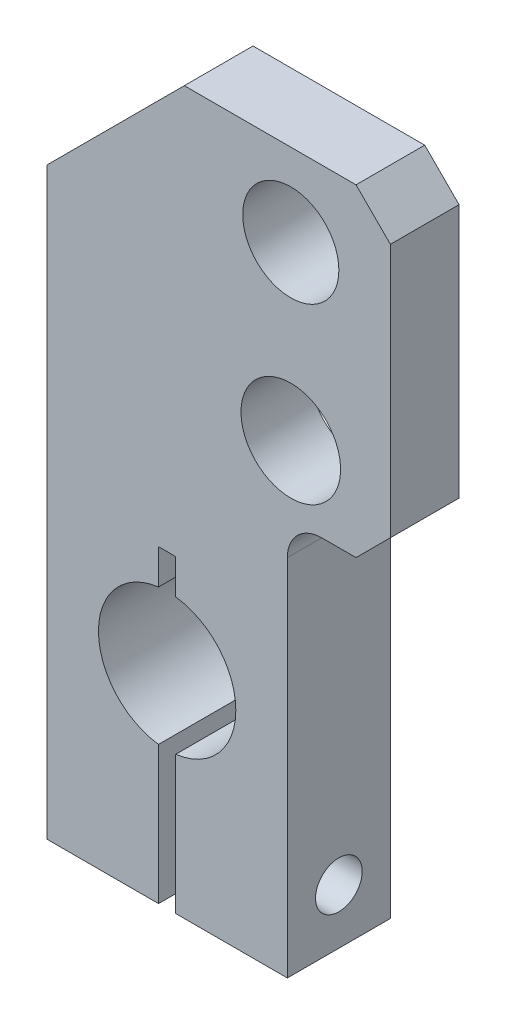
from build123d import *

# Parameters (mm, degrees)
EXTRUDE_1_DEPTH     = 7.5
SKETCH_2_R          = 10
CUT_EXTRUDE_1_DEPTH = 111.933538662
SKETCH_3_W          = 2.5
SKETCH_3_H          = 45
CUT_EXTRUDE_2_DEPTH = 111.933538662
FILLET_1_R          = 5
SKETCH_4_R          = 4.25
CUT_EXTRUDE_3_DEPTH = 16.25
M8X1_25_1_D         = 6.8
SKETCH_10_R         = 7
CUT_EXTRUDE_4_DEPTH = 111.933538662
SKETCH_11_W         = 50
SKETCH_11_H         = 50
CUT_EXTRUDE_5_DEPTH = 5
CHAMFER_2_SIZE      = 5
CHAMFER_3_SIZE      = 20
SKETCH_12_R         = 7.25
CUT_EXTRUDE_6_DEPTH = 111.368700273


with BuildPart() as part:
    # 草图1 → 凸台-拉伸1 (new, symmetric)
    with BuildSketch(Plane.XY):
        Polygon((-17.5, 105), (-17.5, 0), (17.5, 0), (17.5, 58), (32.5, 58), (32.5, 105), align=None)
    extrude(amount=EXTRUDE_1_DEPTH, both=True)

    # 草图2 → 切除-拉伸1 (cut, through all)
    with BuildSketch(Plane.XY.offset(7.5)):
        with Locations((0, 30)):
            Circle(SKETCH_2_R)
    extrude(amount=-CUT_EXTRUDE_1_DEPTH, mode=Mode.SUBTRACT)

    # 草图3 → 切除-拉伸2 (cut, through all)
    with BuildSketch(Plane.XY.offset(7.5)):
        with Locations((0, 22.5)):
            Rectangle(SKETCH_3_W, SKETCH_3_H)
    extrude(amount=-CUT_EXTRUDE_2_DEPTH, mode=Mode.SUBTRACT)

    # 圆角1
    fillet_1_edges = [part.edges().sort_by_distance(p)[0] for p in [
        (17.5, 58, 0),
    ]]
    fillet(fillet_1_edges, radius=FILLET_1_R)

    # 草图4 → 切除-拉伸3 (cut)
    with BuildSketch(Plane(origin=(-17.5, 0, 0), x_dir=(0, 0, -1), z_dir=(1, 0, 0))):
        with Locations(Location((0, 8, 0), (0, 0, 270))):
            Circle(SKETCH_4_R)
    extrude(amount=CUT_EXTRUDE_3_DEPTH, mode=Mode.SUBTRACT)

    # M8x1.25 螺纹孔1 (through all)
    with Locations(Plane(origin=(17.5, 13.24526089, -0.849289526), x_dir=(0, 0, -1), z_dir=(1, 0, 0))):
        with Locations((-0.849289526, -5.24526089)):
            Hole(M8X1_25_1_D / 2)

    # 草图10 → 切除-拉伸4 (cut, through all)
    with BuildSketch(Plane.XY.offset(7.5)):
        with Locations((18, 93)):
            Circle(SKETCH_10_R)
    extrude(amount=-CUT_EXTRUDE_4_DEPTH, mode=Mode.SUBTRACT)

    # 草图11 → 切除-拉伸5 (cut)
    with BuildSketch(Plane(origin=(0, 0, -7.5), x_dir=(-1, 0, 0), z_dir=(0, 0, -1))):
        with Locations((-7.5, 80)):
            Rectangle(SKETCH_11_W, SKETCH_11_H)
    extrude(amount=-CUT_EXTRUDE_5_DEPTH, mode=Mode.SUBTRACT)

    # 倒角2
    chamfer_2_edges = [part.edges().sort_by_distance(p)[0] for p in [
        (32.5, 105, 2.5),
        (32.5, 58, 2.5),
    ]]
    chamfer(chamfer_2_edges, length=CHAMFER_2_SIZE)

    # 倒角3
    chamfer_3_edges = [part.edges().sort_by_distance(p)[0] for p in [
        (-17.5, 105, 2.5),
    ]]
    chamfer(chamfer_3_edges, length=CHAMFER_3_SIZE)

    # 草图12 → 切除-拉伸6 (cut, through all)
    with BuildSketch(Plane(origin=(0, 0, -2.5), x_dir=(-1, 0, 0), z_dir=(0, 0, -1))):
        with Locations((-18, 68)):
            Circle(SKETCH_12_R)
    extrude(amount=-CUT_EXTRUDE_6_DEPTH, mode=Mode.SUBTRACT)


solid = part.part
